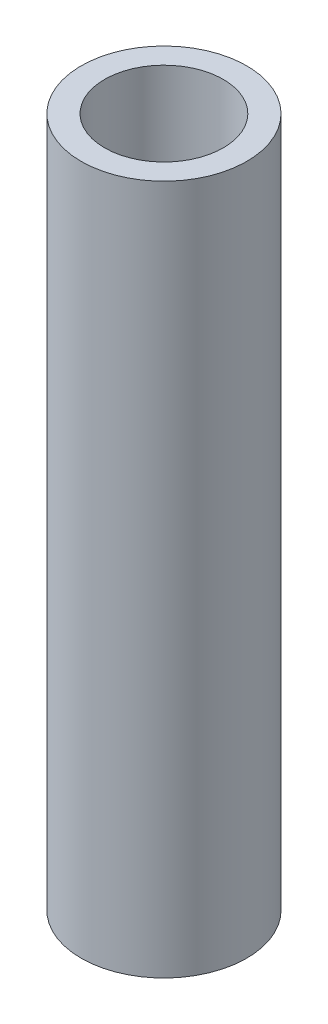
from build123d import *

# Parameters (mm, degrees)
SKETCH1_R           = 10.668
SKETCH1_R_2         = 7.6454
BOSS_EXTRUDE1_DEPTH = 88.9


with BuildPart() as part:
    # Sketch1 → Boss-Extrude1 (new body)
    with BuildSketch(Plane(origin=(0, 0, 0), x_dir=(1, 0, 0), z_dir=(0, 1, 0))):
        with Locations(Location((0, 0, 0), (0, 0, 270))):
            Circle(SKETCH1_R)
        with Locations(Location((0, 0, 0), (0, 0, 270))):
            Circle(SKETCH1_R_2, mode=Mode.SUBTRACT)
    extrude(amount=BOSS_EXTRUDE1_DEPTH)


solid = part.part
